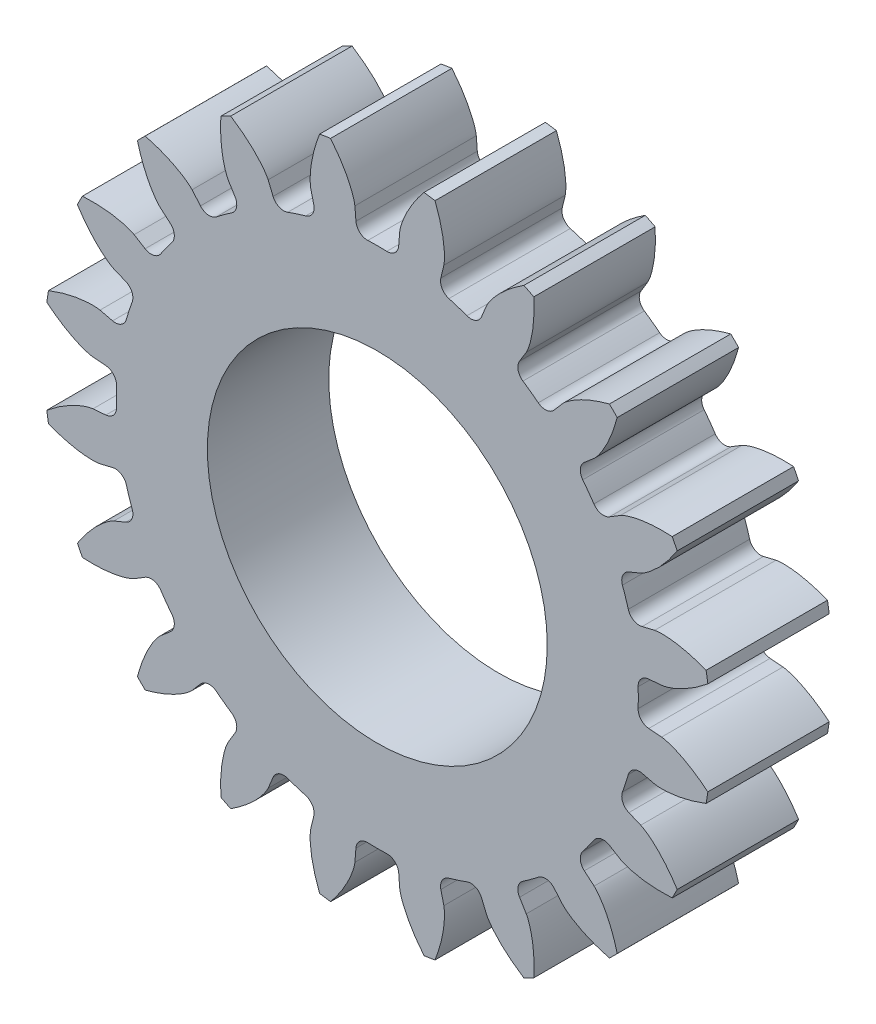
from build123d import *

# Parameters (mm, degrees)
BLANK_SKETCH_R    = 13.75
BLANK_DEPTH       = 5
TOOTH_SPACE_DEPTH = 21.077973005
TEETH_COUNT       = 20
BORE_DEPTH        = 20.892459281
BORE_DEPTH_BACK   = 20.892459281
BORE_SKETCH_R     = 7


with BuildPart() as part:
    # Blank Sketch → Blank (new body)
    with BuildSketch(Plane.XY):
        Circle(BLANK_SKETCH_R)
    extrude(amount=BLANK_DEPTH)

    # Tooth Space Sketch → Tooth Space (cut, symmetric)
    with BuildSketch(Plane.XY):
        with BuildLine():
            Line((11.709860103, 0.922712572), (11.180289267, 0.880983494))
            ThreePointArc((11.180289267, 0.880983494), (10.862988941, 0.723480031), (10.742915644, 0.39020951))
            ThreePointArc((10.742915644, 0.39020951), (10.75, 0), (10.742915644, -0.39020951))
            ThreePointArc((10.742915644, -0.39020951), (10.862988941, -0.723480031), (11.180289267, -0.880983494))
            Line((11.180289267, -0.880983494), (11.709860103, -0.922712572))
            add(Edge.make_bspline(
                [(11.709860103, -0.922712572), (11.715313475, -0.923234617), (11.730580069, -0.924982426), (11.759319753, -0.929405731), (11.80598663, -0.938205714), (11.86506971, -0.951736167), (11.94092317, -0.971871237), (12.029548412, -0.998976801), (12.126085986, -1.032288866), (12.230093072, -1.072304199), (12.332879138, -1.115538905), (12.434437251, -1.161726096), (12.534681177, -1.210479105), (12.654945734, -1.272744636), (12.797491556, -1.351852601), (12.961497116, -1.450701421), (13.144282968, -1.570278326), (13.326873882, -1.699980424), (13.503420438, -1.834000155), (13.677968733, -1.976594979), (13.844122091, -2.119647646), (14.012499078, -2.275384766), (14.16579995, -2.422795632), (14.332640843, -2.595647481), (14.46587003, -2.737409714), (14.599233693, -2.890118061), (14.663505795, -2.96535919), (14.69608147, -3.004195304)],
                knots=[0, 0, 0, 0, 0, 0.005376749, 0.015083688, 0.02853182, 0.046610139, 0.064854849, 0.092110525, 0.119476176, 0.146842496, 0.174208854, 0.201574956, 0.228941013, 0.256307345, 0.307035032, 0.361767352, 0.41649966, 0.471231936, 0.525964282, 0.580696615, 0.635428982, 0.690161387, 0.744893688, 0.799626082, 0.854358408, 0.909090915, 0.909090915, 0.909090915, 0.909090915, 0.909090915], degree=4))
            Line((14.69608147, -3.004195304), (14.69608147, 3.004195304))
            add(Edge.make_bspline(
                [(11.709860103, 0.922712572), (11.715313475, 0.923234617), (11.730580069, 0.924982426), (11.759319753, 0.929405731), (11.80598663, 0.938205714), (11.86506971, 0.951736167), (11.94092317, 0.971871237), (12.029548412, 0.998976801), (12.126085986, 1.032288866), (12.230093072, 1.072304199), (12.332879138, 1.115538905), (12.434437251, 1.161726096), (12.534681177, 1.210479105), (12.654945734, 1.272744636), (12.797491556, 1.351852601), (12.961497116, 1.450701421), (13.144282968, 1.570278326), (13.326873882, 1.699980424), (13.503420438, 1.834000155), (13.677968733, 1.976594979), (13.844122091, 2.119647646), (14.012499078, 2.275384766), (14.16579995, 2.422795632), (14.332640843, 2.595647481), (14.46587003, 2.737409714), (14.599233693, 2.890118061), (14.663505795, 2.96535919), (14.69608147, 3.004195304)],
                knots=[0, 0, 0, 0, 0, 0.005376749, 0.015083688, 0.02853182, 0.046610139, 0.064854849, 0.092110525, 0.119476176, 0.146842496, 0.174208854, 0.201574956, 0.228941013, 0.256307345, 0.307035032, 0.361767352, 0.41649966, 0.471231936, 0.525964282, 0.580696615, 0.635428982, 0.690161387, 0.744893688, 0.799626082, 0.854358408, 0.909090915, 0.909090915, 0.909090915, 0.909090915, 0.909090915], degree=4))
        make_face()
    tooth_space = extrude(amount=TOOTH_SPACE_DEPTH, both=True, mode=Mode.SUBTRACT)

    # Teeth: Tooth Space ×20 about axis
    teeth_axis = Axis((0, 0, -0.25007105), (0, 0, 1))
    for i in range(1, TEETH_COUNT):
        add(tooth_space.rotate(teeth_axis, i * 360 / TEETH_COUNT), mode=Mode.SUBTRACT)

    # Bore Sketch → Bore (cut, two sides: drawn at the far end of the back side and taken through both)
    with BuildSketch(Plane.XY.offset(-BORE_DEPTH_BACK)):
        Circle(BORE_SKETCH_R)
    extrude(amount=BORE_DEPTH + BORE_DEPTH_BACK, mode=Mode.SUBTRACT)


solid = part.part
